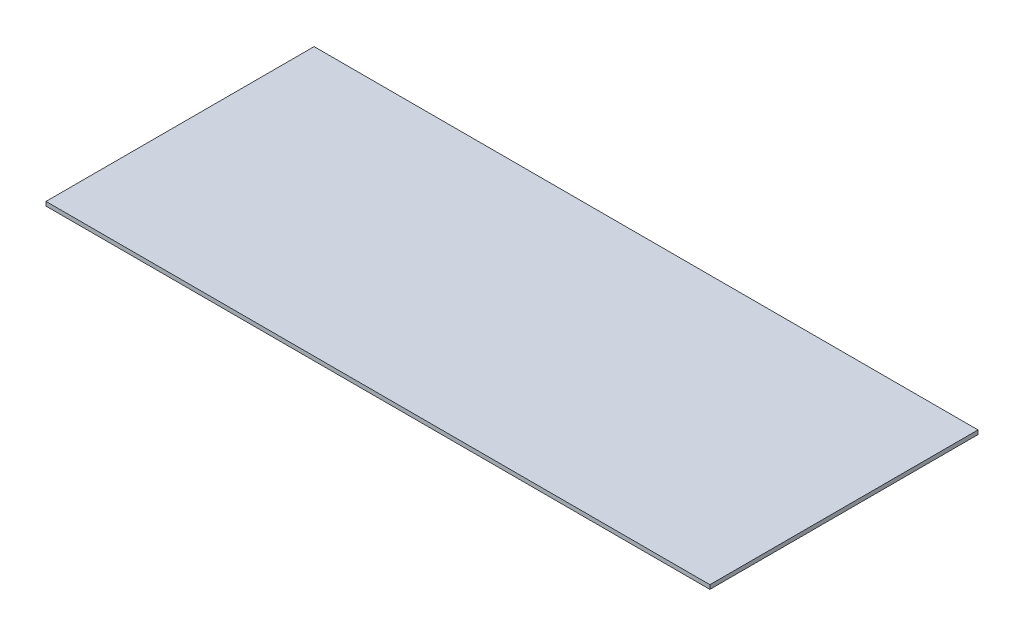
from build123d import *

# Parameters (mm, degrees)
ESQUISSE1_W        = 2600
ESQUISSE1_H        = 1050
BOSS_EXTRU_1_DEPTH = 16


with BuildPart() as part:
    # Esquisse1 → Boss.-Extru.1 (new body)
    with BuildSketch(Plane(origin=(0, 0, 0), x_dir=(1, 0, 0), z_dir=(0, 1, 0))):
        with Locations((1300, 525)):
            Rectangle(ESQUISSE1_W, ESQUISSE1_H)
    extrude(amount=BOSS_EXTRU_1_DEPTH)


solid = part.part
